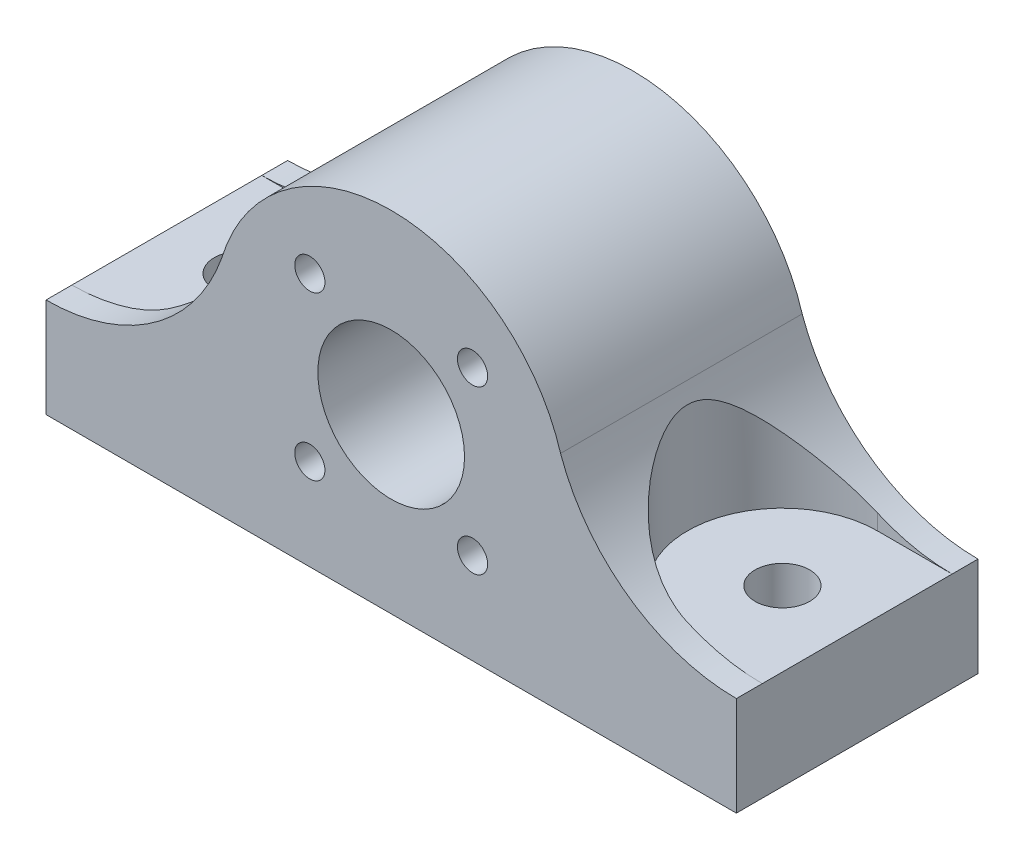
from build123d import *

# Parameters (mm, degrees)
CROQUIS2_R              = 5.1
SALIENTE_EXTRUIR1_DEPTH = 16.8
CROQUIS3_R              = 1.05
CORTAR_EXTRUIR1_DEPTH   = 35.073450075
CORTAR_EXTRUIR2_DEPTH   = 35.073450075
CROQUIS5_R              = 1.9
CORTAR_EXTRUIR3_DEPTH   = 35.073450195


with BuildPart() as part:
    # Croquis2 → Saliente-Extruir1 (new body)
    with BuildSketch(Plane.XY):
        with BuildLine():
            Line((24, 0), (24, -6.9))
            Line((24, -6.9), (-24, -6.9))
            Line((-24, -6.9), (-24, 0))
            ThreePointArc((-24, 0), (-16.512763431, 2.381234531), (-11.776565713, 8.65))
            ThreePointArc((-11.776565713, 8.65), (0, 17.4), (11.776565713, 8.65))
            ThreePointArc((11.776565713, 8.65), (16.512763431, 2.381234531), (24, 0))
        make_face()
        with Locations((0, 5.1)):
            Circle(CROQUIS2_R, mode=Mode.SUBTRACT)
    extrude(amount=SALIENTE_EXTRUIR1_DEPTH)

    # Croquis3 → Cortar-Extruir1 (cut, through all)
    with BuildSketch(Plane.XY.offset(16.8)):
        with Locations((5.656854249, 10.756854249)):
            Circle(CROQUIS3_R)
        with Locations((5.656854249, -0.556854249)):
            Circle(CROQUIS3_R)
        with Locations((-5.656854249, -0.556854249)):
            Circle(CROQUIS3_R)
        with Locations((-5.656854249, 10.756854249)):
            Circle(CROQUIS3_R)
    extrude(amount=-CORTAR_EXTRUIR1_DEPTH, mode=Mode.SUBTRACT)

    # Croquis4 → Cortar-Extruir2 (cut, through all)
    with BuildSketch(Plane(origin=(0, 0, 0), x_dir=(1, 0, 0), z_dir=(0, 1, 0))):
        with BuildLine():
            Line((-24, -1.8), (-24, -15))
            Line((-24, -15), (-18.8, -15))
            ThreePointArc((-18.8, -15), (-12.2, -8.4), (-18.8, -1.8))
            Line((-18.8, -1.8), (-24, -1.8))
        make_face()
        with BuildLine():
            Line((24, -15), (18.8, -15))
            ThreePointArc((18.8, -15), (12.2, -8.4), (18.8, -1.8))
            Line((18.8, -1.8), (24, -1.8))
            Line((24, -1.8), (24, -15))
        make_face()
    extrude(amount=CORTAR_EXTRUIR2_DEPTH, mode=Mode.SUBTRACT)

    # Croquis5 → Cortar-Extruir3 (cut, through all)
    with BuildSketch(Plane(origin=(0, 0, 0), x_dir=(1, 0, 0), z_dir=(0, 1, 0))):
        with Locations(Location((-18.8, -8.4, 0), (0, 0, 270))):
            Circle(CROQUIS5_R)
        with Locations(Location((18.8, -8.4, 0), (0, 0, 270))):
            Circle(CROQUIS5_R)
    extrude(amount=-CORTAR_EXTRUIR3_DEPTH, mode=Mode.SUBTRACT)


solid = part.part
